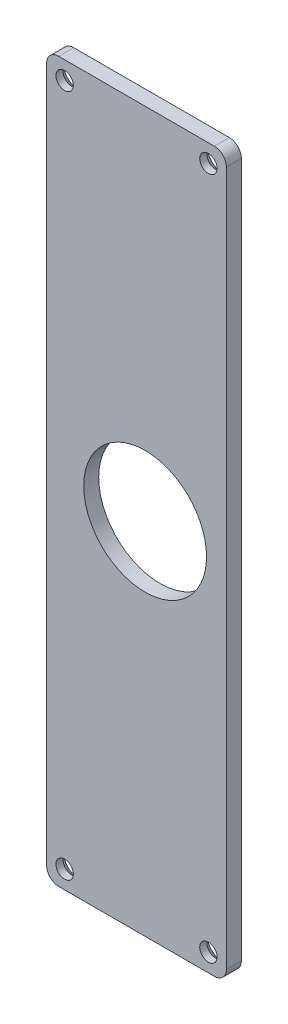
from build123d import *

# Parameters (mm, degrees)
BOSS_EXTRUDE1_DEPTH                          = 2.5
CSK_FOR_M2_5_COUNTERSUNK_FLAT_HEAD_S_2_COUNT = 2
CSK_FOR_M2_5_COUNTERSUNK_FLAT_HEAD_S_2_PITCH = 24
CSK_FOR_M2_5_COUNTERSUNK_FLAT_HEAD_S_3_COUNT = 2
CSK_FOR_M2_5_COUNTERSUNK_FLAT_HEAD_S_3_PITCH = 114
CSK_FOR_M2_5_COUNTERSUNK_FLAT_HEAD_S_4_COUNT = 2
CSK_FOR_M2_5_COUNTERSUNK_FLAT_HEAD_S_4_PITCH = 116.498927034
SKETCH4_R                                    = 10.25
CUT_EXTRUDE1_DEPTH                           = 132.231695022


with BuildPart() as part:
    # Sketch1 → Boss-Extrude1 (new body)
    with BuildSketch(Plane.XY):
        with BuildLine():
            Line((-63.122572744, 90.432106023), (-63.122572744, -25.567893977))
            ThreePointArc((-63.122572744, -25.567893977), (-63.708359182, -26.98210754), (-65.122572744, -27.567893977))
            Line((-65.122572744, -27.567893977), (-91.122572744, -27.567893977))
            ThreePointArc((-91.122572744, -27.567893977), (-92.536786306, -26.98210754), (-93.122572744, -25.567893977))
            Line((-93.122572744, -25.567893977), (-93.122572744, 90.432106023))
            ThreePointArc((-93.122572744, 90.432106023), (-92.536786306, 91.846319585), (-91.122572744, 92.432106023))
            Line((-91.122572744, 92.432106023), (-65.122572744, 92.432106023))
            ThreePointArc((-65.122572744, 92.432106023), (-63.708359182, 91.846319585), (-63.122572744, 90.432106023))
        make_face()
    extrude(amount=BOSS_EXTRUDE1_DEPTH)

    # Sketch3 → CSK for M2.5 Countersunk Flat Head Screw2 (revolve, cut)
    with BuildSketch(Plane(origin=(-66.122572744, 89.432106023, 0), x_dir=(0, 1, 0), z_dir=(1, 0, 0))):
        Polygon((0, 0), (0, 2.5), (1.45, 2.5), (1.45, 1.3), (2.75, 0), align=None)
    csk_for_m2_5_countersunk_flat_head_screw = revolve(axis=Axis((-66.122572744, 89.432106023, -6.35), (0, 0, 1)), mode=Mode.SUBTRACT)

    # CSK for M2.5 Countersunk Flat Head S 2: CSK for M2.5 Countersunk Flat Head Screw2 ×2
    with Locations(*[(-i * CSK_FOR_M2_5_COUNTERSUNK_FLAT_HEAD_S_2_PITCH, 0, 0) for i in range(1, CSK_FOR_M2_5_COUNTERSUNK_FLAT_HEAD_S_2_COUNT)]):
        add(csk_for_m2_5_countersunk_flat_head_screw, mode=Mode.SUBTRACT)

    # CSK for M2.5 Countersunk Flat Head S 3: CSK for M2.5 Countersunk Flat Head Screw2 ×2
    with Locations(*[(0, -i * CSK_FOR_M2_5_COUNTERSUNK_FLAT_HEAD_S_3_PITCH, 0) for i in range(1, CSK_FOR_M2_5_COUNTERSUNK_FLAT_HEAD_S_3_COUNT)]):
        add(csk_for_m2_5_countersunk_flat_head_screw, mode=Mode.SUBTRACT)

    # CSK for M2.5 Countersunk Flat Head S 4: CSK for M2.5 Countersunk Flat Head Screw2 ×2
    with Locations(*[Vector(-0.20601048104984201, -0.978549784986749, 0) * (i * CSK_FOR_M2_5_COUNTERSUNK_FLAT_HEAD_S_4_PITCH) for i in range(1, CSK_FOR_M2_5_COUNTERSUNK_FLAT_HEAD_S_4_COUNT)]):
        add(csk_for_m2_5_countersunk_flat_head_screw, mode=Mode.SUBTRACT)

    # Sketch4 → Cut-Extrude1 (cut, through all)
    with BuildSketch(Plane(origin=(0, 0, 0), x_dir=(-1, 0, 0), z_dir=(0, 0, -1))):
        with Locations((76.682572744, 32.432106023)):
            Circle(SKETCH4_R)
    extrude(amount=-CUT_EXTRUDE1_DEPTH, mode=Mode.SUBTRACT)


solid = part.part
